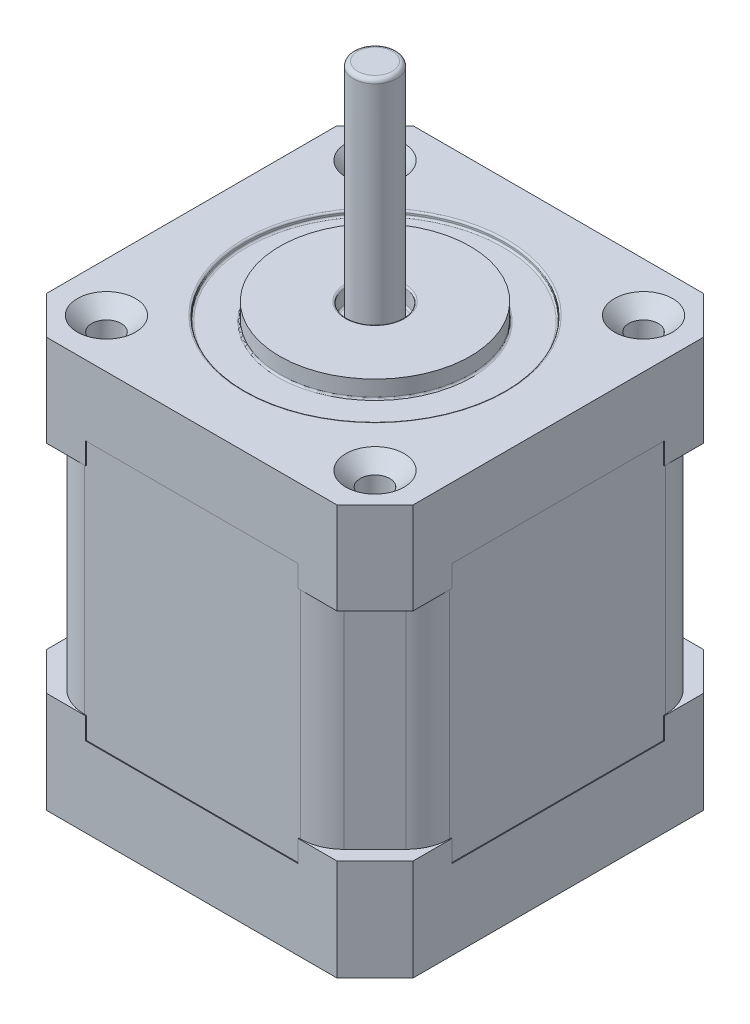
from build123d import *

# Parameters (mm, degrees)
SALIENTE_EXTRUIR1_DEPTH                              = 9.2
SALIENTE_EXTRUIR2_DEPTH                              = 2.5
REFRENTADO_PARA_TORNILLO_CON_CABEZA_TRON_D           = 3.4
REFRENTADO_PARA_TORNILLO_CON_CABEZA_TRON_CBORE_D     = 7
REFRENTADO_PARA_TORNILLO_CON_CABEZA_TRON_CBORE_DEPTH = 2.4
SALIENTE_EXTRUIR3_DEPTH                              = 30
REDONDEO1_R                                          = 5
SALIENTE_EXTRUIR4_DEPTH                              = 8.1
SALIENTE_EXTRUIR5_DEPTH                              = 2.5
REFRENTADO_PARA_TORNILLO_TAP_N_CON_CABEZ_D           = 3.4
REFRENTADO_PARA_TORNILLO_TAP_N_CON_CABEZ_DEPTH       = 10.6
REFRENTADO_PARA_TORNILLO_TAP_N_CON_CABEZ_CSINK_D     = 6.72
REFRENTADO_PARA_TORNILLO_TAP_N_CON_CABEZ_CSINK_ANGLE = 90
CROQUIS14_R                                          = 15
CORTAR_EXTRUIR1_DEPTH                                = 0.6
CROQUIS15_R                                          = 11
CROQUIS15_R_2                                        = 3.25
SALIENTE_EXTRUIR6_DEPTH                              = 2
REDONDEO2_R                                          = 0.2
CROQUIS16_R                                          = 2.5
SALIENTE_EXTRUIR7_DEPTH                              = 26
REDONDEO3_R                                          = 0.5


with BuildPart() as part:
    # Croquis1 → Saliente-Extruir1 (new body)
    with BuildSketch(Plane(origin=(0, 0, 0), x_dir=(1, 0, 0), z_dir=(0, 1, 0))):
        Polygon((-16.75, 21.15), (16.75, 21.15), (21.15, 16.75), (21.15, -16.75), (16.75, -21.15), (-16.75, -21.15), (-21.15, -16.75), (-21.15, 16.75), align=None)
    extrude(amount=SALIENTE_EXTRUIR1_DEPTH)

    # Croquis2 → Saliente-Extruir2 (add)
    with BuildSketch(Plane(origin=(0, 9.2, 0), x_dir=(1, 0, 0), z_dir=(0, 1, 0))):
        Polygon((-12.25, 12.25), (-12.25, 21.15), (-16.75, 21.15), (-21.15, 16.75), (-21.15, 12.25), align=None)
        Polygon((12.25, 21.15), (16.75, 21.15), (21.15, 16.75), (21.15, 12.25), (12.25, 12.25), align=None)
        Polygon((12.25, -12.25), (12.25, -21.15), (16.75, -21.15), (21.15, -16.75), (21.15, -12.25), align=None)
        Polygon((-12.25, -21.15), (-16.75, -21.15), (-21.15, -16.75), (-21.15, -12.25), (-12.25, -12.25), align=None)
    extrude(amount=SALIENTE_EXTRUIR2_DEPTH)

    # Refrentado para tornillo con cabeza troncocónica de M31 (through all)
    with Locations(Plane.XZ):
        with Locations((15.5, 15.5), (15.5, -15.5), (-15.5, 15.5), (-15.5, -15.5)):
            CounterBoreHole(REFRENTADO_PARA_TORNILLO_CON_CABEZA_TRON_D / 2, REFRENTADO_PARA_TORNILLO_CON_CABEZA_TRON_CBORE_D / 2, REFRENTADO_PARA_TORNILLO_CON_CABEZA_TRON_CBORE_DEPTH)

    # Croquis5 → Saliente-Extruir3 (add)
    with BuildSketch(Plane(origin=(0, 9.2, 0), x_dir=(1, 0, 0), z_dir=(0, 1, 0))):
        Polygon((-14.530689758, 21.05), (14.530689758, 21.05), (21.05, 14.530689758), (21.05, -14.530689758), (14.530689758, -21.05), (-14.530689758, -21.05), (-21.05, -14.530689758), (-21.05, 14.530689758), align=None)
    extrude(amount=SALIENTE_EXTRUIR3_DEPTH)

    # Redondeo1
    redondeo1_edges = [part.edges().sort_by_distance(p)[0] for p in [
        (21.05, 25.45, -14.530689758),
        (14.530689758, 25.45, -21.05),
        (21.05, 25.45, 14.530689758),
        (-21.05, 25.45, -14.530689758),
        (-21.05, 25.45, 14.530689758),
        (-14.530689758, 25.45, 21.05),
        (-14.530689758, 25.45, -21.05),
        (14.530689758, 25.45, 21.05),
    ]]
    fillet(redondeo1_edges, radius=REDONDEO1_R)

    # Croquis7 → Saliente-Extruir4 (add)
    with BuildSketch(Plane(origin=(0, 39.2, 0), x_dir=(1, 0, 0), z_dir=(0, 1, 0))):
        Polygon((-16.75, 21.15), (16.75, 21.15), (21.15, 16.75), (21.15, -16.75), (16.75, -21.15), (-16.75, -21.15), (-21.15, -16.75), (-21.15, 16.75), align=None)
    extrude(amount=SALIENTE_EXTRUIR4_DEPTH)

    # Croquis9 → Saliente-Extruir5 (add)
    with BuildSketch(Plane.XZ.offset(-39.2)):
        Polygon((-12.25, 12.25), (-12.25, 21.15), (-16.75, 21.15), (-21.15, 16.75), (-21.15, 12.25), align=None)
        Polygon((12.25, 21.15), (16.75, 21.15), (21.15, 16.75), (21.15, 12.25), (12.25, 12.25), align=None)
        Polygon((12.25, -12.25), (12.25, -21.15), (16.75, -21.15), (21.15, -16.75), (21.15, -12.25), align=None)
        Polygon((-12.25, -21.15), (-16.75, -21.15), (-21.15, -16.75), (-21.15, -12.25), (-12.25, -12.25), align=None)
    extrude(amount=SALIENTE_EXTRUIR5_DEPTH)

    # Refrentado para tornillo tapón con cabeza plana de clavija de M31
    with Locations(Plane(origin=(-15.5, 47.3, -15.5), x_dir=(0, 0, 1), z_dir=(0, 1, 0))):
        with Locations((0, 0), (0, 31), (31, 31), (31, 0)):
            CounterSinkHole(REFRENTADO_PARA_TORNILLO_TAP_N_CON_CABEZ_D / 2, REFRENTADO_PARA_TORNILLO_TAP_N_CON_CABEZ_CSINK_D / 2, depth=REFRENTADO_PARA_TORNILLO_TAP_N_CON_CABEZ_DEPTH, counter_sink_angle=REFRENTADO_PARA_TORNILLO_TAP_N_CON_CABEZ_CSINK_ANGLE)

    # Croquis14 → Cortar-Extruir1 (cut)
    with BuildSketch(Plane(origin=(0, 47.3, 0), x_dir=(1, 0, 0), z_dir=(0, 1, 0))):
        with Locations(Location((0, 0, 0), (0, 0, 270))):
            Circle(CROQUIS14_R)
    extrude(amount=-CORTAR_EXTRUIR1_DEPTH, mode=Mode.SUBTRACT)

    # Croquis15 → Saliente-Extruir6 (add)
    with BuildSketch(Plane(origin=(0, 46.7, 0), x_dir=(1, 0, 0), z_dir=(0, 1, 0))):
        with Locations(Location((0, 0, 0), (0, 0, 270))):
            Circle(CROQUIS15_R)
        with Locations(Location((0, 0, 0), (0, 0, 270))):
            Circle(CROQUIS15_R_2, mode=Mode.SUBTRACT)
    extrude(amount=SALIENTE_EXTRUIR6_DEPTH)

    # Redondeo2
    redondeo2_edges = [part.edges().sort_by_distance(p)[0] for p in [
        (0, 46.7, -15),
        (0, 47.3, -15),
        (0, 46.7, -3.25),
        (0, 46.7, -11),
        (0, 48.7, -3.25),
    ]]
    fillet(redondeo2_edges, radius=REDONDEO2_R)

    # Croquis16 → Saliente-Extruir7 (add)
    with BuildSketch(Plane(origin=(0, 46.7, 0), x_dir=(1, 0, 0), z_dir=(0, 1, 0))):
        with Locations(Location((0, 0, 0), (0, 0, 90))):
            Circle(CROQUIS16_R)
    extrude(amount=SALIENTE_EXTRUIR7_DEPTH)

    # Redondeo3
    redondeo3_edges = [part.edges().sort_by_distance(p)[0] for p in [
        (0, 72.7, 2.5),
    ]]
    fillet(redondeo3_edges, radius=REDONDEO3_R)


solid = part.part
